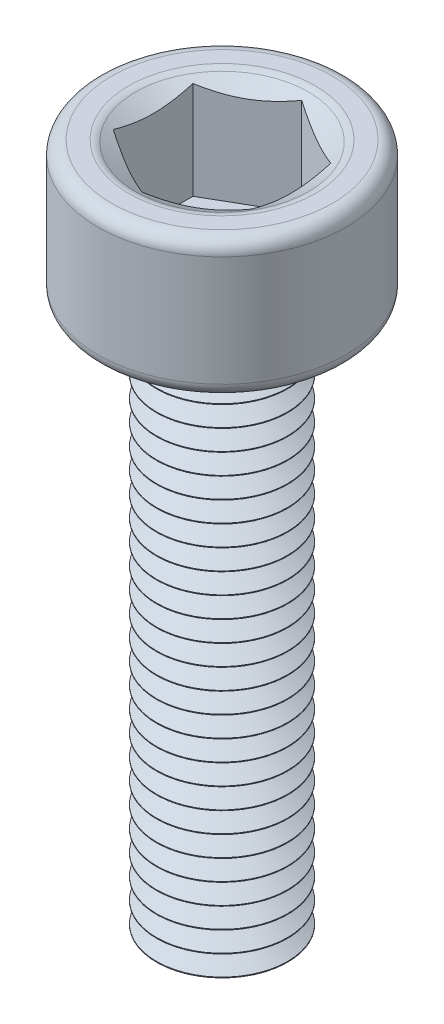
from build123d import *

# Parameters (mm, degrees)
CUT_EXTRUDE1_DEPTH = 1.5
FILLET1_R          = 0.2
LPATTERN1_COUNT    = 26
LPATTERN1_PITCH    = 0.3


with BuildPart() as part:
    # Sketch1 → Revolve1 (revolve)
    with BuildSketch(Plane.XY, mode=Mode.PRIVATE) as revolve1_sk:
        with BuildLine():
            Line((0, 2), (0, -8))
            Line((0, -8), (0.95, -8))
            Line((0.95, -8), (0.95, 0))
            Line((0.95, 0), (1.6, 0))
            ThreePointArc((1.6, 0), (1.741421356, 0.058578644), (1.8, 0.2))
            Line((1.8, 0.2), (1.8, 1.8))
            ThreePointArc((1.8, 1.8), (1.741421356, 1.941421356), (1.6, 2))
            Line((1.6, 2), (0, 2))
        make_face()
    revolve(revolve1_sk.sketch.rotate(Axis((0, 2, 0), (0, -1, 0)), 180), axis=Axis((0, 2, 0), (0, -1, 0)))

    # Sketch2 → Cut-Extrude1 (cut)
    with BuildSketch(Plane(origin=(0, 2, 0), x_dir=(1, 0, 0), z_dir=(0, 1, 0))):
        Polygon((1, 0.577350269), (0, 1.154700538), (-1, 0.577350269), (-1, -0.577350269), (0, -1.154700538), (1, -0.577350269), align=None)
    extrude(amount=-CUT_EXTRUDE1_DEPTH, mode=Mode.SUBTRACT)

    # Cut-Extrude2 cone 1 section (through the dimple's axis) → Cut-Extrude2 (revolve, cut)
    with BuildSketch(Plane(origin=(0, 2, 0), x_dir=(0, 0, 1), z_dir=(1, 0, 0))):
        Polygon((0, 0), (1.3, 0), (0, 0.75055535), align=None)
    revolve(axis=Axis((0, 2, 0), (0, -1, 0)), mode=Mode.SUBTRACT)

    # Fillet1
    fillet1_edges = [part.edges().sort_by_distance(p)[0] for p in [
        (0, 2, -1.3),
    ]]
    fillet(fillet1_edges, radius=FILLET1_R)

    # Sketch4 → Cut-Revolve1 (revolve, cut)
    with BuildSketch(Plane.XY, mode=Mode.PRIVATE) as cut_revolve1_sk:
        Polygon((1.259807621, -7.85), (1.259807621, -8.15), (0.959807621, -8.15), (0.7, -8), (0.959807621, -7.85), align=None)
    cut_revolve1 = revolve(cut_revolve1_sk.sketch.rotate(Axis((0, 0, 0), (0, -1, 0)), 180), axis=Axis((0, 0, 0), (0, -1, 0)), mode=Mode.SUBTRACT)

    # LPattern1: Cut-Revolve1 ×26
    with Locations(*[(0, i * LPATTERN1_PITCH, 0) for i in range(1, LPATTERN1_COUNT)]):
        add(cut_revolve1, mode=Mode.SUBTRACT)


solid = part.part
